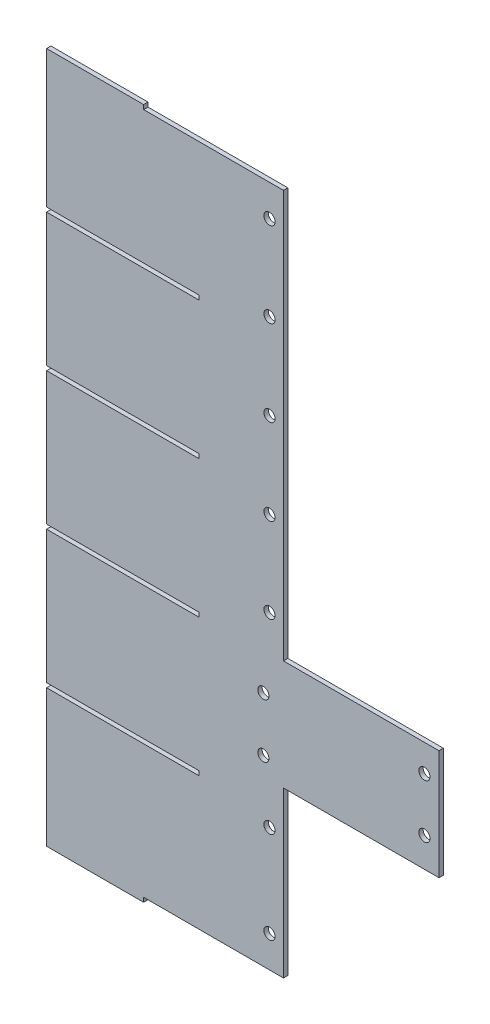
from build123d import *

# Parameters (mm, degrees)
BOSS_EXTRUDE2_DEPTH = 3.175
BOSS_EXTRUDE3_DEPTH = 3.175
BOSS_EXTRUDE6_DEPTH = 3.175
SKETCH8_W           = 70.49262
SKETCH8_H           = 3.175
BOSS_EXTRUDE7_DEPTH = 3.175
SKETCH14_R          = 4.064
CUT_EXTRUDE1_DEPTH  = 371.49176257
SKETCH15_R          = 4.064
CUT_EXTRUDE2_DEPTH  = 371.49176257


with BuildPart() as part:
    # Sketch1 → Boss-Extrude2 (new body)
    with BuildSketch(Plane.XY):
        Polygon((129.013076168, 254.245404572), (-18.685383832, 254.245404572), (-18.685383832, 157.666984572), (92.088461168, 157.666984572), (92.088461168, 154.491984572), (-18.685383832, 154.491984572), (-18.685383832, 57.913564572), (92.088461168, 57.913564572), (92.088461168, 54.738564572), (-18.685383832, 54.738564572), (-18.685383832, -41.839855428), (92.088461168, -41.839855428), (92.088461168, -45.014855428), (-18.685383832, -45.014855428), (-18.685383832, -141.593275428), (92.088461168, -141.593275428), (92.088461168, -144.768275428), (-18.685383832, -144.768275428), (-18.685383832, -241.346695428), (129.013076168, -241.346695428), align=None)
    extrude(amount=BOSS_EXTRUDE2_DEPTH)

    # Sketch2 → Boss-Extrude3 (add, through all)
    with BuildSketch(Plane.XY.offset(3.175)):
        Polygon((129.013076168, 254.245404572), (129.013076168, -241.346695428), (153.407236168, -241.346695428), (153.407236168, -227.262720585), (153.407236168, -187.892720585), (153.407236168, -143.180775428), (153.407236168, 240.16142973), (153.407236168, 254.245404572), align=None)
    extrude(amount=-BOSS_EXTRUDE3_DEPTH)

    # Sketch7 → Boss-Extrude6 (add, through all)
    with BuildSketch(Plane.XY.offset(3.175)):
        Polygon((153.22938521, -121.781069434), (153.407236168, -41.839855428), (266.437236168, -41.839855428), (266.437236168, -121.781069434), align=None)
    extrude(amount=-BOSS_EXTRUDE6_DEPTH)

    # Sketch8 → Boss-Extrude7 (add, through all)
    with BuildSketch(Plane.XY.offset(3.175)):
        with Locations((16.560926168, 255.832904572)):
            Rectangle(SKETCH8_W, SKETCH8_H)
        with Locations((16.560926168, -242.934195428)):
            Rectangle(SKETCH8_W, SKETCH8_H)
    extrude(amount=-BOSS_EXTRUDE7_DEPTH)

    # Sketch14 → Cut-Extrude1 (cut, through all)
    with BuildSketch(Plane(origin=(0, 0, 0), x_dir=(-1, 0, 0), z_dir=(0, 0, -1))):
        with Locations((-143.247236168, -218.414588646)):
            Circle(SKETCH14_R)
        with Locations((-143.247236168, -151.753275428)):
            Circle(SKETCH14_R)
        with Locations((-255.799716168, -100.445275428)):
            Circle(SKETCH14_R)
        with Locations((-255.799716168, -61.596962209)):
            Circle(SKETCH14_R)
        with Locations((-143.247236168, -16.439855428)):
            Circle(SKETCH14_R)
        with Locations((-143.247236168, 45.232941839)):
            Circle(SKETCH14_R)
        with Locations((-143.247236168, 107.436721182)):
            Circle(SKETCH14_R)
        with Locations((-143.247236168, 169.640500525)):
            Circle(SKETCH14_R)
        with Locations((-143.247236168, 231.313297791)):
            Circle(SKETCH14_R)
    extrude(amount=-CUT_EXTRUDE1_DEPTH, mode=Mode.SUBTRACT)

    # Sketch15 → Cut-Extrude2 (cut, through all)
    with BuildSketch(Plane(origin=(0, 0, 0), x_dir=(-1, 0, 0), z_dir=(0, 0, -1))):
        with Locations((-138.792076168, -108.552320428)):
            Circle(SKETCH15_R)
        with Locations((-138.792076168, -69.242010428)):
            Circle(SKETCH15_R)
    extrude(amount=-CUT_EXTRUDE2_DEPTH, mode=Mode.SUBTRACT)


solid = part.part
